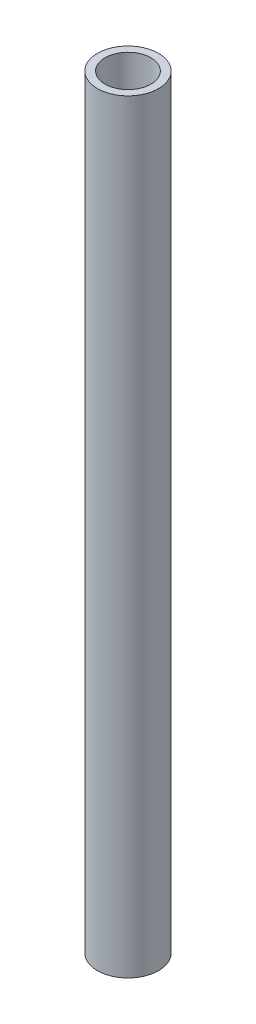
from build123d import *

# Parameters (mm, degrees)
SKETCH1_R           = 4
SKETCH1_R_2         = 3
BOSS_EXTRUDE1_DEPTH = 100


with BuildPart() as part:
    # Sketch1 → Boss-Extrude1 (new body)
    with BuildSketch(Plane(origin=(0, 0, 0), x_dir=(1, 0, 0), z_dir=(0, 1, 0))):
        with Locations(Location((0, 0, 0), (0, 0, 270))):
            Circle(SKETCH1_R)
        with Locations(Location((0, 0, 0), (0, 0, 270))):
            Circle(SKETCH1_R_2, mode=Mode.SUBTRACT)
    extrude(amount=BOSS_EXTRUDE1_DEPTH)


solid = part.part
